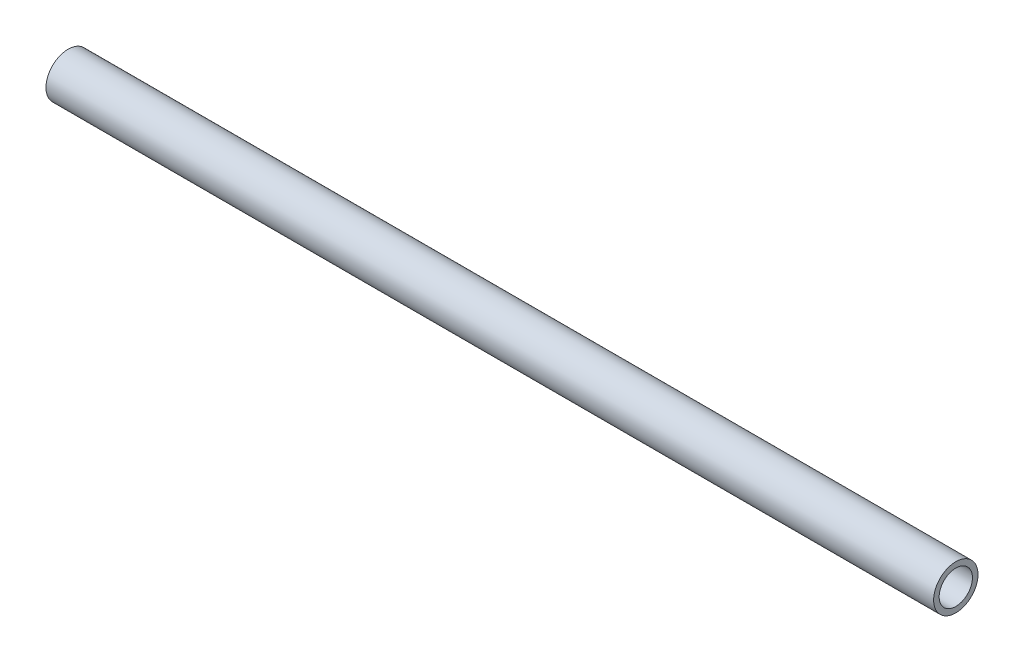
from build123d import *

# Parameters (mm, degrees)
SKETCH3_R           = 6.35
SKETCH3_R_2         = 4.7625
BOSS_EXTRUDE1_DEPTH = 127


with BuildPart() as part:
    # Sketch3 → Boss-Extrude1 (new, symmetric)
    with BuildSketch(Plane(origin=(0, 0, 0), x_dir=(0, 0, -1), z_dir=(1, 0, 0))):
        Circle(SKETCH3_R)
        Circle(SKETCH3_R_2, mode=Mode.SUBTRACT)
    extrude(amount=BOSS_EXTRUDE1_DEPTH, both=True)


solid = part.part
